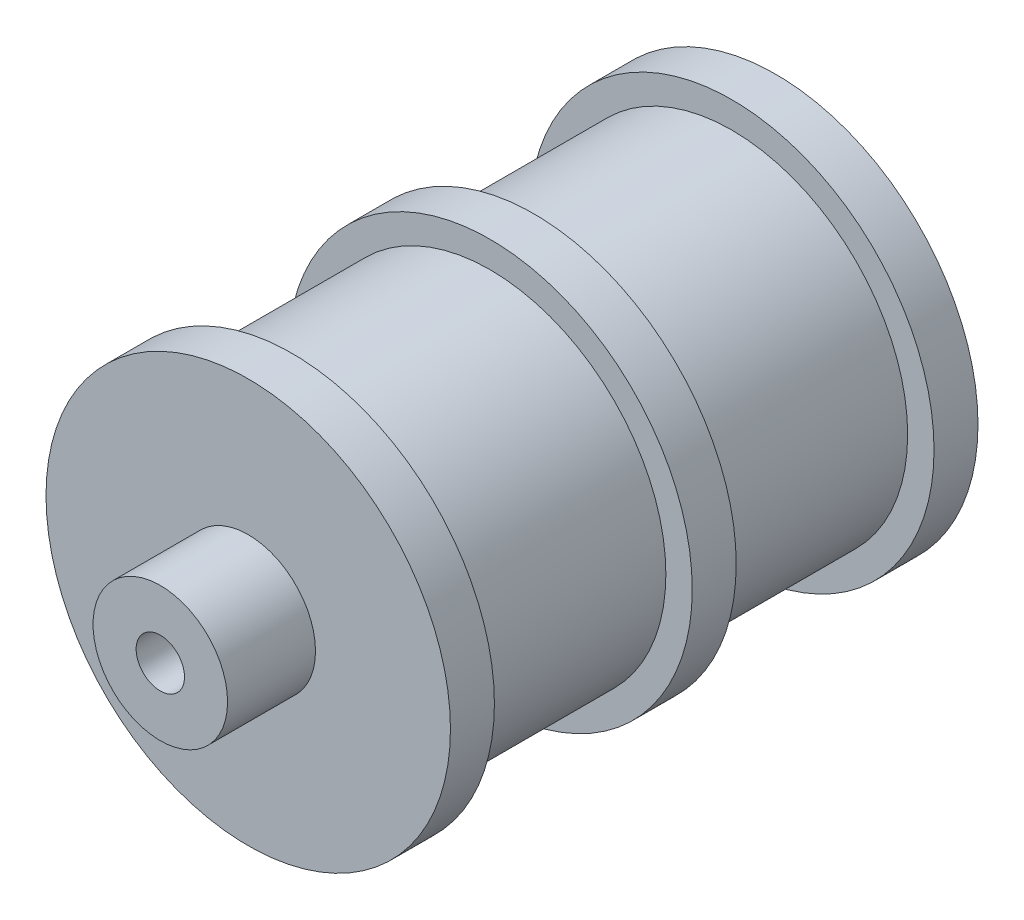
from build123d import *

# Parameters (mm, degrees)
BOSS_EXTRUDE1_DEPTH      = 2.5
BOSS_EXTRUDE1_DEPTH_BACK = 2.5
SKETCH1_R                = 23
BOSS_EXTRUDE2_DEPTH      = 30
BOSS_EXTRUDE2_DEPTH_BACK = 30
SKETCH3_R                = 20
SKETCH4_R                = 23
SKETCH4_R_2              = 20
BOSS_EXTRUDE3_DEPTH      = 5
SKETCH5_R                = 2.75
CUT_EXTRUDE1_DEPTH       = 69.249542123
SKETCH6_R                = 7.65
SKETCH6_R_2              = 2.75
BOSS_EXTRUDE4_DEPTH      = 10


with BuildPart() as part:
    # Sketch1 → Boss-Extrude1 (new, two sides: drawn at the far end of the back side and taken through both)
    with BuildSketch(Plane.XY.offset(-BOSS_EXTRUDE1_DEPTH_BACK)):
        Circle(SKETCH1_R)
    extrude(amount=BOSS_EXTRUDE1_DEPTH + BOSS_EXTRUDE1_DEPTH_BACK)

    # Sketch3 → Boss-Extrude2 (add, two sides: drawn at the far end of the back side and taken through both)
    with BuildSketch(Plane.XY.offset(-BOSS_EXTRUDE2_DEPTH_BACK)):
        Circle(SKETCH3_R)
    extrude(amount=BOSS_EXTRUDE2_DEPTH + BOSS_EXTRUDE2_DEPTH_BACK)

    # Sketch4 → Boss-Extrude3 (add)
    with BuildSketch(Plane.XY.offset(30)):
        Circle(SKETCH4_R)
        Circle(SKETCH4_R_2, mode=Mode.SUBTRACT)
    boss_extrude3 = extrude(amount=-BOSS_EXTRUDE3_DEPTH)

    # Mirror5: Boss-Extrude3 across plane
    add(boss_extrude3.mirror(Plane.XY))

    # Sketch5 → Cut-Extrude1 (cut, through all)
    with BuildSketch(Plane.XY.offset(30)):
        Circle(SKETCH5_R)
    extrude(amount=-CUT_EXTRUDE1_DEPTH, mode=Mode.SUBTRACT)


with BuildPart() as body_2:
    # Sketch6 → Boss-Extrude4 (new body)
    with BuildSketch(Plane.XY.offset(30)):
        Circle(SKETCH6_R)
        Circle(SKETCH6_R_2, mode=Mode.SUBTRACT)
    extrude(amount=BOSS_EXTRUDE4_DEPTH)


solid = Compound([part.part, body_2.part])
